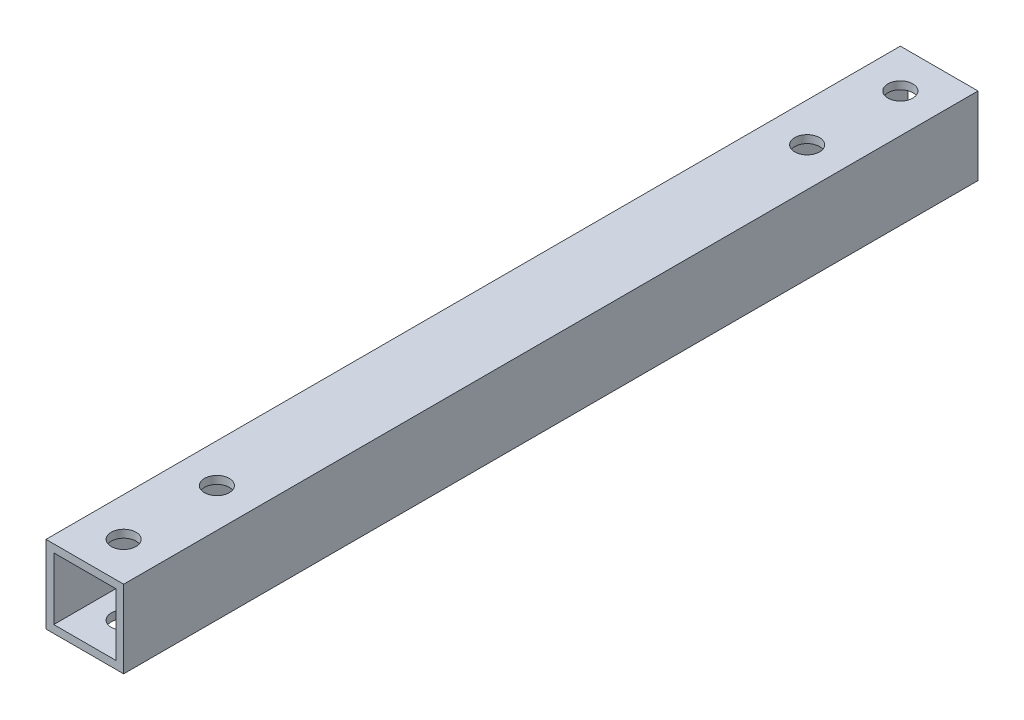
from build123d import *

# Parameters (mm, degrees)
SKETCH_282_W          = 10
SKETCH_282_H          = 10
SKETCH_282_W_2        = 8
SKETCH_282_H_2        = 8
EXTRUDE_339_DEPTH     = 110
SKETCH_411_R          = 1.6
CUT_EXTRUDE_780_DEPTH = 111.566721937


with BuildPart() as part:
    # Sketch 282 → Extrude 339 (new body)
    with BuildSketch(Plane.XY):
        Rectangle(SKETCH_282_W, SKETCH_282_H)
        Rectangle(SKETCH_282_W_2, SKETCH_282_H_2, mode=Mode.SUBTRACT)
    extrude(amount=EXTRUDE_339_DEPTH)

    # Sketch 411 → Cut-Extrude 780 (cut, through all)
    with BuildSketch(Plane(origin=(0, 5, 0), x_dir=(1, 0, 0), z_dir=(0, 1, 0))):
        with Locations(Location((0, -5, 0), (0, 0, 270))):
            Circle(SKETCH_411_R)
        with Locations(Location((0, -17, 0), (0, 0, 270))):
            Circle(SKETCH_411_R)
        with Locations(Location((0, -93, 0), (0, 0, 270))):
            Circle(SKETCH_411_R)
        with Locations(Location((0, -105, 0), (0, 0, 270))):
            Circle(SKETCH_411_R)
    extrude(amount=-CUT_EXTRUDE_780_DEPTH, mode=Mode.SUBTRACT)


solid = part.part
